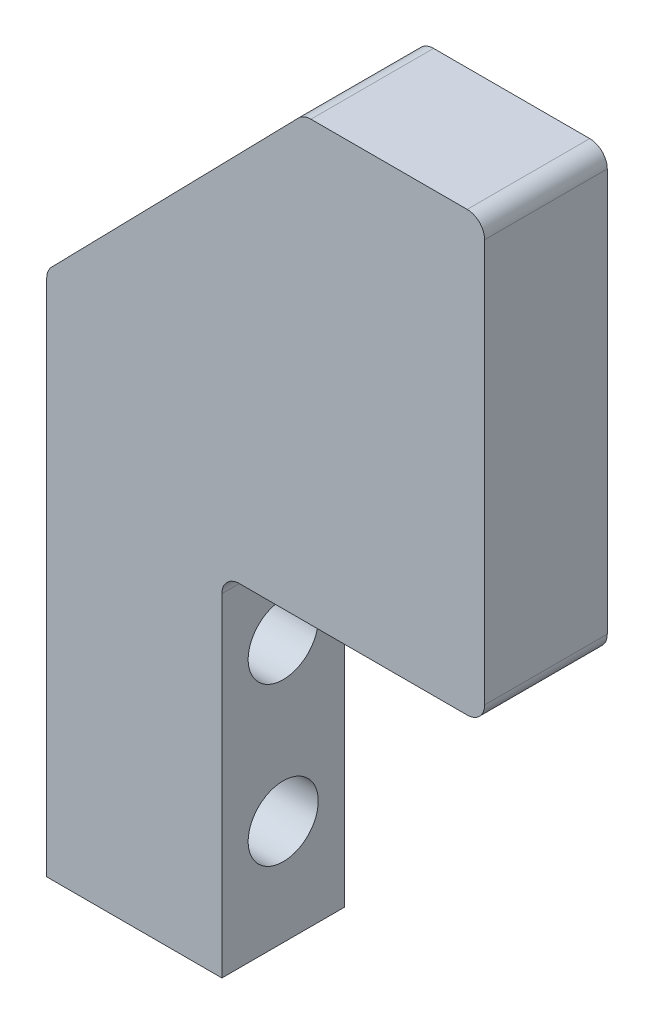
from build123d import *

# Parameters (mm, degrees)
BOSS_EXTRUDE1_DEPTH = 70
SKETCH2_R           = 20
CUT_EXTRUDE1_DEPTH  = 129


with BuildPart() as part:
    # Sketch1 → Boss-Extrude1 (new body)
    with BuildSketch(Plane.XY):
        with BuildLine():
            Line((-187.20703125, 37.086522646), (-187.20703125, -258.837890625))
            Line((-187.20703125, -258.837890625), (-87.20703125, -258.837890625))
            Line((-87.20703125, -258.837890625), (-87.20703125, -68.837890625))
            ThreePointArc((-87.20703125, -68.837890625), (-84.278099062, -61.766822813), (-77.20703125, -58.837890625))
            Line((-77.20703125, -58.837890625), (52.79296875, -58.837890625))
            ThreePointArc((52.79296875, -58.837890625), (59.864036562, -55.908958437), (62.79296875, -48.837890625))
            Line((62.79296875, -48.837890625), (62.79296875, 181.162109375))
            ThreePointArc((62.79296875, 181.162109375), (59.864036562, 188.233177187), (52.79296875, 191.162109375))
            Line((52.79296875, 191.162109375), (-36.375896467, 191.162109375))
            ThreePointArc((-36.375896467, 191.162109375), (-40.255270839, 190.378966458), (-43.527024298, 188.152200272))
            Line((-43.527024298, 188.152200272), (-184.35815908, 44.076613543))
            ThreePointArc((-184.35815908, 44.076613543), (-186.467465319, 40.860692866), (-187.20703125, 37.086522646))
        make_face()
    extrude(amount=BOSS_EXTRUDE1_DEPTH)

    # Sketch2 → Cut-Extrude1 (cut)
    with BuildSketch(Plane(origin=(-87.20703125, 0, 0), x_dir=(0, 0, -1), z_dir=(1, 0, 0))):
        with Locations((-35, -108.837890625)):
            Circle(SKETCH2_R)
        with Locations((-35, -198.837890625)):
            Circle(SKETCH2_R)
    extrude(amount=-CUT_EXTRUDE1_DEPTH, mode=Mode.SUBTRACT)


solid = part.part
